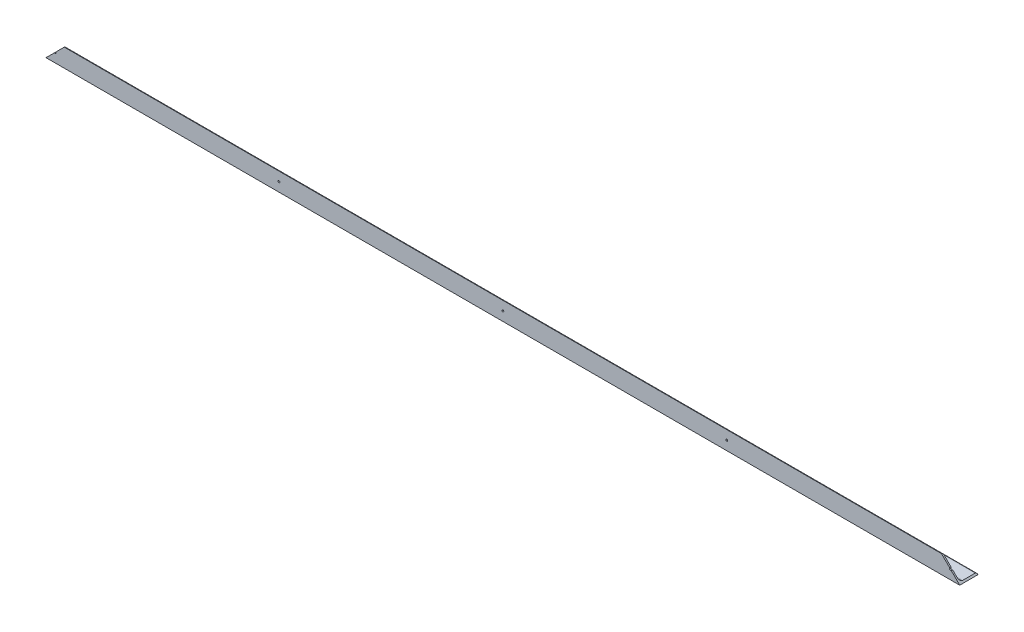
from build123d import *

# Parameters (mm, degrees)
L_ANGLE_EQUAL_40X40X3_4_DEPTH = 2000
SKETCH14_R                    = 2
CUT_EXTRUDE1_DEPTH            = 2001.799840064


with BuildPart() as part:
    # Sketch13 → L angle (equal) 40X40X3(4) (new body)
    with BuildSketch(Plane(origin=(0, 0, 0), x_dir=(0, 0, -1), z_dir=(1, 0, 0))):
        with BuildLine():
            Line((0, 40), (0, 0))
            Line((0, 0), (40, 0))
            ThreePointArc((40, 0), (39.121320344, 2.121320344), (37, 3))
            Line((37, 3), (9, 3))
            ThreePointArc((9, 3), (4.757359313, 4.757359313), (3, 9))
            Line((3, 9), (3, 37))
            ThreePointArc((3, 37), (2.121320344, 39.121320344), (0, 40))
        make_face()
    extrude(amount=L_ANGLE_EQUAL_40X40X3_4_DEPTH)

    # Sketch14 → Cut-Extrude1 (cut, through all)
    with BuildSketch(Plane.XY):
        with Locations((1000, 20)):
            Circle(SKETCH14_R)
        with Locations((510, 20)):
            Circle(SKETCH14_R)
        with Locations((1490, 20)):
            Circle(SKETCH14_R)
        with BuildLine():
            Line((2000, 0), (2000, 40))
            Line((2000, 40), (1960, 40))
            Line((1960, 40), (1978.585786438, 21.414213562))
            ThreePointArc((1978.585786438, 21.414213562), (1978.585786438, 18.585786438), (1981.414213562, 18.585786438))
            Line((1981.414213562, 18.585786438), (2000, 0))
        make_face()
        with BuildLine():
            Line((0, 40), (0, 0))
            Line((0, 0), (18.585786438, 18.585786438))
            ThreePointArc((18.585786438, 18.585786438), (21.414213562, 18.585786438), (21.414213562, 21.414213562))
            Line((21.414213562, 21.414213562), (40, 40))
            Line((40, 40), (0, 40))
        make_face()
    extrude(amount=-CUT_EXTRUDE1_DEPTH, mode=Mode.SUBTRACT)


solid = part.part
